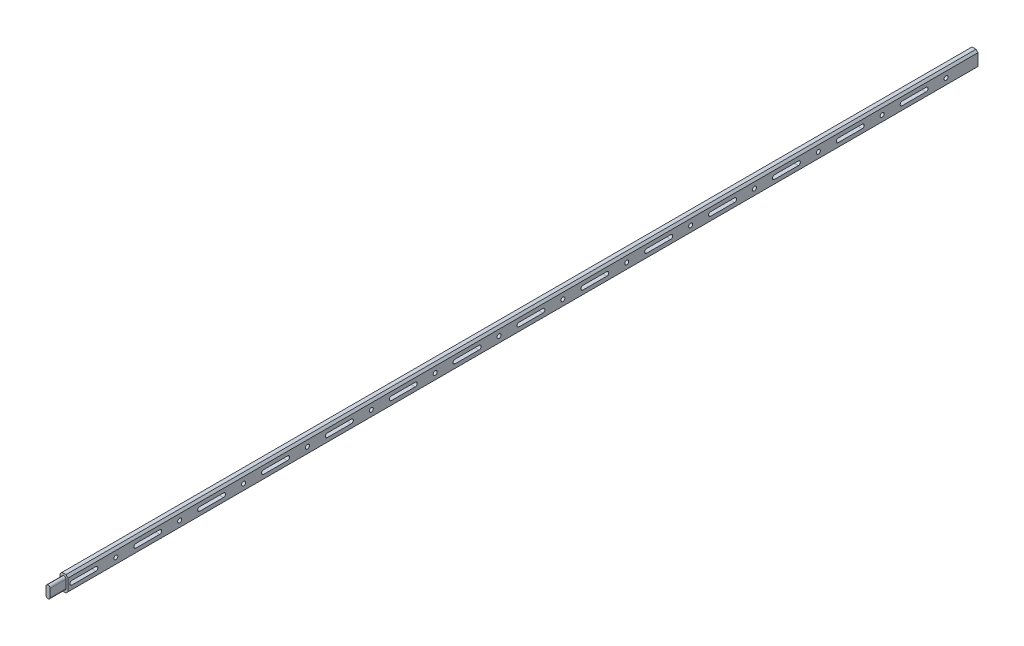
from build123d import *

# Parameters (mm, degrees)
BOSS_EXTRUDE1_DEPTH = 749.3
BOSS_EXTRUDE2_DEPTH = 12.7
SKETCH3_W           = 25.4
SKETCH3_H           = 12.7
CUT_EXTRUDE1_DEPTH  = 6.35
SKETCH4_R           = 1.5875
CUT_EXTRUDE2_DEPTH  = 70.358
SKETCH5_R           = 1.5875
CUT_EXTRUDE3_DEPTH  = 70.358


with BuildPart() as part:
    # Sketch1 → Boss-Extrude1 (new body)
    with BuildSketch(Plane.XY):
        Polygon((0, 11.1125), (1.5875, 12.7), (4.7625, 12.7), (6.35, 11.1125), (6.35, 1.5875), (4.7625, 0), (1.5875, 0), (0, 1.5875), align=None)
    extrude(amount=BOSS_EXTRUDE1_DEPTH)

    # Sketch2 → Boss-Extrude2 (add)
    with BuildSketch(Plane.XY.offset(749.3)):
        with BuildLine():
            Line((4.7625, 9.525), (4.7625, 3.175))
            ThreePointArc((4.7625, 3.175), (3.175, 1.5875), (1.5875, 3.175))
            Line((1.5875, 3.175), (1.5875, 9.525))
            ThreePointArc((1.5875, 9.525), (3.175, 11.1125), (4.7625, 9.525))
        make_face()
    extrude(amount=BOSS_EXTRUDE2_DEPTH)

    # Sketch3 → Cut-Extrude1 (cut)
    with BuildSketch(Plane.ZY):
        with Locations((12.7, 6.35)):
            Rectangle(SKETCH3_W, SKETCH3_H)
    extrude(amount=-CUT_EXTRUDE1_DEPTH, mode=Mode.SUBTRACT)

    # Sketch4 → Cut-Extrude2 (cut)
    with BuildSketch(Plane.ZY):
        with BuildLine():
            Line((117.475, 4.7625), (136.525, 4.7625))
            ThreePointArc((136.525, 4.7625), (138.1125, 6.35), (136.525, 7.9375))
            Line((136.525, 7.9375), (117.475, 7.9375))
            ThreePointArc((117.475, 7.9375), (115.8875, 6.35), (117.475, 4.7625))
        make_face()
        with Locations((152.4, 6.35)):
            Circle(SKETCH4_R)
        with BuildLine():
            Line((66.675, 4.7625), (85.725, 4.7625))
            ThreePointArc((85.725, 4.7625), (87.3125, 6.35), (85.725, 7.9375))
            Line((85.725, 7.9375), (66.675, 7.9375))
            ThreePointArc((66.675, 7.9375), (65.0875, 6.35), (66.675, 4.7625))
        make_face()
        with Locations((101.6, 6.35)):
            Circle(SKETCH4_R)
        with BuildLine():
            Line((168.275, 4.7625), (187.325, 4.7625))
            ThreePointArc((187.325, 4.7625), (188.9125, 6.35), (187.325, 7.9375))
            Line((187.325, 7.9375), (168.275, 7.9375))
            ThreePointArc((168.275, 7.9375), (166.6875, 6.35), (168.275, 4.7625))
        make_face()
        with Locations((203.2, 6.35)):
            Circle(SKETCH4_R)
        with BuildLine():
            Line((219.075, 4.7625), (238.125, 4.7625))
            ThreePointArc((238.125, 4.7625), (239.7125, 6.35), (238.125, 7.9375))
            Line((238.125, 7.9375), (219.075, 7.9375))
            ThreePointArc((219.075, 7.9375), (217.4875, 6.35), (219.075, 4.7625))
        make_face()
        with Locations((254, 6.35)):
            Circle(SKETCH4_R)
        with BuildLine():
            Line((269.875, 4.7625), (288.925, 4.7625))
            ThreePointArc((288.925, 4.7625), (290.5125, 6.35), (288.925, 7.9375))
            Line((288.925, 7.9375), (269.875, 7.9375))
            ThreePointArc((269.875, 7.9375), (268.2875, 6.35), (269.875, 4.7625))
        make_face()
        with Locations((304.8, 6.35)):
            Circle(SKETCH4_R)
        with BuildLine():
            Line((320.675, 4.7625), (339.725, 4.7625))
            ThreePointArc((339.725, 4.7625), (341.3125, 6.35), (339.725, 7.9375))
            Line((339.725, 7.9375), (320.675, 7.9375))
            ThreePointArc((320.675, 7.9375), (319.0875, 6.35), (320.675, 4.7625))
        make_face()
        with Locations((355.6, 6.35)):
            Circle(SKETCH4_R)
        with BuildLine():
            Line((371.475, 4.7625), (390.525, 4.7625))
            ThreePointArc((390.525, 4.7625), (392.1125, 6.35), (390.525, 7.9375))
            Line((390.525, 7.9375), (371.475, 7.9375))
            ThreePointArc((371.475, 7.9375), (369.8875, 6.35), (371.475, 4.7625))
        make_face()
        with Locations((406.4, 6.35)):
            Circle(SKETCH4_R)
        with BuildLine():
            Line((422.275, 4.7625), (441.325, 4.7625))
            ThreePointArc((441.325, 4.7625), (442.9125, 6.35), (441.325, 7.9375))
            Line((441.325, 7.9375), (422.275, 7.9375))
            ThreePointArc((422.275, 7.9375), (420.6875, 6.35), (422.275, 4.7625))
        make_face()
        with Locations((457.2, 6.35)):
            Circle(SKETCH4_R)
        with BuildLine():
            Line((473.075, 4.7625), (492.125, 4.7625))
            ThreePointArc((492.125, 4.7625), (493.7125, 6.35), (492.125, 7.9375))
            Line((492.125, 7.9375), (473.075, 7.9375))
            ThreePointArc((473.075, 7.9375), (471.4875, 6.35), (473.075, 4.7625))
        make_face()
        with Locations((508, 6.35)):
            Circle(SKETCH4_R)
        with BuildLine():
            Line((523.875, 4.7625), (542.925, 4.7625))
            ThreePointArc((542.925, 4.7625), (544.5125, 6.35), (542.925, 7.9375))
            Line((542.925, 7.9375), (523.875, 7.9375))
            ThreePointArc((523.875, 7.9375), (522.2875, 6.35), (523.875, 4.7625))
        make_face()
        with Locations((558.8, 6.35)):
            Circle(SKETCH4_R)
        with BuildLine():
            Line((574.675, 4.7625), (593.725, 4.7625))
            ThreePointArc((593.725, 4.7625), (595.3125, 6.35), (593.725, 7.9375))
            Line((593.725, 7.9375), (574.675, 7.9375))
            ThreePointArc((574.675, 7.9375), (573.0875, 6.35), (574.675, 4.7625))
        make_face()
        with Locations((609.6, 6.35)):
            Circle(SKETCH4_R)
        with BuildLine():
            Line((625.475, 4.7625), (644.525, 4.7625))
            ThreePointArc((644.525, 4.7625), (646.1125, 6.35), (644.525, 7.9375))
            Line((644.525, 7.9375), (625.475, 7.9375))
            ThreePointArc((625.475, 7.9375), (623.8875, 6.35), (625.475, 4.7625))
        make_face()
        with Locations((660.4, 6.35)):
            Circle(SKETCH4_R)
        with BuildLine():
            Line((676.275, 4.7625), (695.325, 4.7625))
            ThreePointArc((695.325, 4.7625), (696.9125, 6.35), (695.325, 7.9375))
            Line((695.325, 7.9375), (676.275, 7.9375))
            ThreePointArc((676.275, 7.9375), (674.6875, 6.35), (676.275, 4.7625))
        make_face()
        with Locations((711.2, 6.35)):
            Circle(SKETCH4_R)
        with BuildLine():
            Line((727.075, 4.7625), (746.125, 4.7625))
            ThreePointArc((746.125, 4.7625), (747.7125, 6.35), (746.125, 7.9375))
            Line((746.125, 7.9375), (727.075, 7.9375))
            ThreePointArc((727.075, 7.9375), (725.4875, 6.35), (727.075, 4.7625))
        make_face()
    extrude(amount=-CUT_EXTRUDE2_DEPTH, mode=Mode.SUBTRACT)

    # Sketch5 → Cut-Extrude3 (cut)
    with BuildSketch(Plane.ZY):
        with Locations((50.8, 6.35)):
            Circle(SKETCH5_R)
    extrude(amount=-CUT_EXTRUDE3_DEPTH, mode=Mode.SUBTRACT)


solid = part.part
